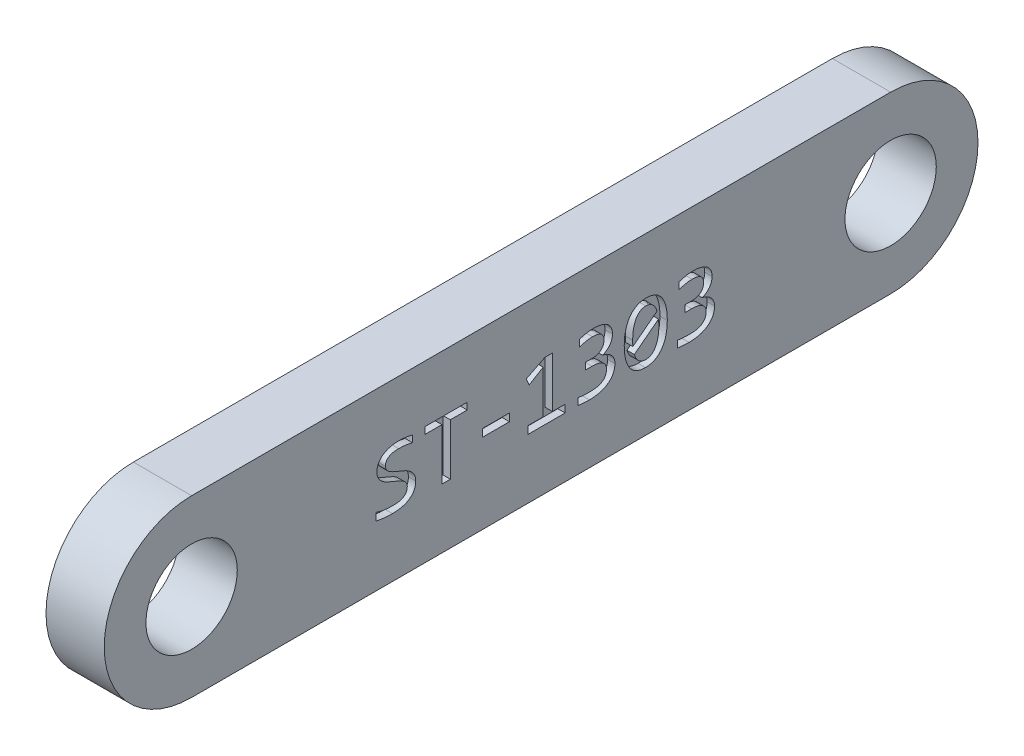
from build123d import *

# Parameters (mm, degrees)
SKETCH1_R           = 2.4892
BOSS_EXTRUDE1_DEPTH = 1.5875
CUT_EXTRUDE1_START  = 1.5875
SKETCH2_W           = 1.472463768
SKETCH2_H           = 0.414130435
CUT_EXTRUDE1_DEPTH  = 0.4


with BuildPart() as part:
    # Sketch1 → Boss-Extrude1 (new, symmetric)
    with BuildSketch(Plane(origin=(0, 0, 0), x_dir=(0, 0, -1), z_dir=(1, 0, 0))):
        with BuildLine():
            Line((0, 4.7625), (38.1, 4.7625))
            ThreePointArc((38.1, 4.7625), (42.8625, 0), (38.1, -4.7625))
            Line((38.1, -4.7625), (0, -4.7625))
            ThreePointArc((0, -4.7625), (-4.7625, 0), (0, 4.7625))
        make_face()
        with Locations((38.1, 0)):
            Circle(SKETCH1_R, mode=Mode.SUBTRACT)
        Circle(SKETCH1_R, mode=Mode.SUBTRACT)
    extrude(amount=BOSS_EXTRUDE1_DEPTH, both=True)

    # Sketch2 → Cut-Extrude1 (cut)
    # profile 1 of 7: a face of its own
    with BuildSketch(Plane(origin=(0, 0, 0), x_dir=(0, 0, -1), z_dir=(1, 0, 0)).offset(CUT_EXTRUDE1_START)):
        with BuildLine():
            add(Edge.make_bspline(
                [(12.214476634, -0.65142106), (12.213443369, -0.688159023), (12.211438851, -0.759430053), (12.193802576, -0.863137638), (12.164390835, -0.959466266), (12.123974417, -1.049075326), (12.071981556, -1.130337377), (12.012593943, -1.206184721), (11.941680158, -1.272900368), (11.863119538, -1.333648082), (11.775685006, -1.387110283), (11.679152831, -1.432103611), (11.574846345, -1.470973785), (11.462475753, -1.502314905), (11.343045812, -1.52667839), (11.217146031, -1.543415301), (11.085408956, -1.554711552), (10.995596429, -1.555970444), (10.94979706, -1.556612409)],
                knots=[0, 0, 0, 0, 1.005643061, 1.95093061, 2.870738502, 3.757832008, 4.633806625, 5.507195241, 6.389247641, 7.292512577, 8.223494331, 9.189475669, 10.205094408, 11.269007441, 12.381228937, 13.540657028, 14.745872513, 16, 16, 16, 16], degree=3))
            add(Edge.make_bspline(
                [(10.94979706, -1.556612409), (10.907611362, -1.55613974), (10.823441949, -1.555196664), (10.698275131, -1.549415195), (10.57582162, -1.539864414), (10.457911238, -1.528379665), (10.345437594, -1.51561287), (10.239890724, -1.500847792), (10.142601973, -1.483679476), (10.081003705, -1.470725736), (10.051795475, -1.464583424)],
                knots=[0, 0, 0, 0, 1.119729043, 2.234096861, 3.324996266, 4.379512959, 5.378439906, 6.329323539, 7.207810484, 8, 8, 8, 8], degree=3))
            Line((10.051795475, -1.464583424), (10.051795475, -1.050452989))
            add(Edge.make_bspline(
                [(10.051795475, -1.050452989), (10.083066619, -1.061167433), (10.146961446, -1.083059742), (10.247186434, -1.108737432), (10.352319162, -1.132852752), (10.463358638, -1.152999601), (10.581386657, -1.168856158), (10.706853532, -1.180007882), (10.840180745, -1.187559738), (10.931571883, -1.188178409), (10.978556118, -1.188496467)],
                knots=[0, 0, 0, 0, 0.842364813, 1.72116351, 2.635659137, 3.591954833, 4.596841017, 5.670471508, 6.802388115, 8, 8, 8, 8], degree=3))
            add(Edge.make_bspline(
                [(10.978556118, -1.188496467), (11.012124092, -1.188150916), (11.076690625, -1.187486264), (11.169727713, -1.180537478), (11.255161814, -1.171478019), (11.332808883, -1.155742491), (11.403448204, -1.13763077), (11.467297249, -1.114582973), (11.524255281, -1.087154756), (11.575315924, -1.05640649), (11.619076011, -1.020879624), (11.657442035, -0.982592348), (11.688230889, -0.939881043), (11.713240908, -0.893759324), (11.731729494, -0.844071217), (11.744568659, -0.79094792), (11.752645298, -0.734588688), (11.753759647, -0.695785956), (11.754331706, -0.675866259)],
                knots=[0, 0, 0, 0, 1.523194236, 2.929797672, 4.233142745, 5.41923506, 6.522104548, 7.540643951, 8.494207191, 9.387815665, 10.238903194, 11.04655015, 11.840679357, 12.619387111, 13.4214478, 14.239285369, 15.096122854, 16, 16, 16, 16], degree=3))
            add(Edge.make_bspline(
                [(11.754331706, -0.675866259), (11.753617789, -0.655168662), (11.752222944, -0.614729909), (11.737975558, -0.55671446), (11.715699869, -0.502914283), (11.683042578, -0.454932565), (11.64466461, -0.409849663), (11.599579242, -0.368539388), (11.549811308, -0.328593215), (11.474296221, -0.278359125), (11.368629665, -0.21933206), (11.22786985, -0.160304066), (11.078602687, -0.10103639), (10.925414461, -0.039219908), (10.772265291, 0.026398534), (10.622019925, 0.095914262), (10.481106958, 0.175663234), (10.374996988, 0.254795587), (10.300860905, 0.326051703), (10.25042507, 0.38310586), (10.207148959, 0.445408524), (10.167171545, 0.51075624), (10.13589481, 0.582972546), (10.114194946, 0.661378834), (10.099794155, 0.745984932), (10.098486738, 0.80444304), (10.097809967, 0.834703261)],
                knots=[0, 0, 0, 0, 0.619815692, 1.2109895, 1.781199776, 2.357496674, 2.943929778, 3.554333405, 4.188738872, 4.856760597, 6.272963823, 7.811824644, 9.431291666, 11.092170587, 12.76691914, 14.429617761, 16.056218893, 17.616396577, 18.384212937, 19.138341755, 19.896401647, 20.65718422, 21.4332038, 22.247956952, 23.09307348, 24, 24, 24, 24], degree=3))
            add(Edge.make_bspline(
                [(10.097809967, 0.834703261), (10.098634876, 0.861836872), (10.10028672, 0.91617076), (10.113931978, 0.997358421), (10.135392497, 1.077836699), (10.165605392, 1.157312879), (10.205180459, 1.233947572), (10.253344347, 1.307416814), (10.312504195, 1.375060707), (10.380341053, 1.438843451), (10.458822469, 1.497200247), (10.546967552, 1.550434811), (10.646210317, 1.596120221), (10.754651004, 1.637578545), (10.874475771, 1.670487821), (11.005090521, 1.694064821), (11.146520815, 1.707371518), (11.244309938, 1.709378282), (11.294905755, 1.710416576)],
                knots=[0, 0, 0, 0, 0.784067079, 1.570060577, 2.373452904, 3.189297991, 4.022898002, 4.862695015, 5.722463422, 6.614650011, 7.550049647, 8.544652583, 9.586108202, 10.704431291, 11.897970904, 13.172772987, 14.537200697, 16, 16, 16, 16], degree=3))
            add(Edge.make_bspline(
                [(11.294905755, 1.710416576), (11.32319619, 1.710233284), (11.381990773, 1.709852358), (11.472582943, 1.703339903), (11.567071787, 1.695126455), (11.663152012, 1.683360619), (11.75907173, 1.669928472), (11.853240246, 1.654092121), (11.943637964, 1.637189944), (12.002165468, 1.624509074), (12.030418663, 1.618387591)],
                knots=[0, 0, 0, 0, 0.91416123, 1.89985515, 2.934260182, 3.979599391, 5.027947684, 6.064525625, 7.065681407, 8, 8, 8, 8], degree=3))
            Line((12.030418663, 1.618387591), (12.030418663, 1.250271649))
            add(Edge.make_bspline(
                [(12.030418663, 1.250271649), (11.967531984, 1.264219497), (11.842382364, 1.291976854), (11.65403204, 1.319666174), (11.469061191, 1.339057536), (11.346959464, 1.341232526), (11.286997014, 1.342300634)],
                knots=[0, 0, 0, 0, 1.029411825, 2.048613503, 3.041701399, 4, 4, 4, 4], degree=3))
            add(Edge.make_bspline(
                [(11.286997014, 1.342300634), (11.256792478, 1.341838949), (11.198244252, 1.340944023), (11.113482511, 1.335441734), (11.034999558, 1.325366015), (10.962715655, 1.311738641), (10.896431041, 1.294874563), (10.836349715, 1.273449488), (10.782802678, 1.247297358), (10.734888983, 1.217913787), (10.693312093, 1.184650055), (10.656762591, 1.149336305), (10.626247731, 1.110936446), (10.601615766, 1.069457325), (10.582339287, 1.02545043), (10.567368735, 0.97909978), (10.559770611, 0.92961858), (10.558569299, 0.895837799), (10.557954895, 0.878560824)],
                knots=[0, 0, 0, 0, 1.491437277, 2.890989782, 4.191431573, 5.395946596, 6.521058188, 7.565423013, 8.539223212, 9.458660202, 10.334655275, 11.163081303, 11.963306063, 12.748694206, 13.538083787, 14.331542868, 15.146677777, 16, 16, 16, 16], degree=3))
            add(Edge.make_bspline(
                [(10.557954895, 0.878560824), (10.55866801, 0.85786525), (10.560061286, 0.817430449), (10.574372917, 0.759170866), (10.596767701, 0.705219408), (10.628078637, 0.655740046), (10.667964248, 0.61164136), (10.711863795, 0.568745113), (10.761807969, 0.528502055), (10.837175045, 0.476975492), (10.943773895, 0.418255952), (11.083843783, 0.356648272), (11.23393873, 0.299069491), (11.386765296, 0.236646792), (11.540464332, 0.171710992), (11.665729153, 0.11130215), (11.762947312, 0.059446088), (11.831076799, 0.015975006), (11.895765964, -0.029872834), (11.95524772, -0.08052479), (12.011067295, -0.134097194), (12.060965511, -0.192983093), (12.105476651, -0.255900155), (12.143856573, -0.323481317), (12.176684169, -0.395863901), (12.198091223, -0.475498372), (12.212498139, -0.561265081), (12.213802007, -0.62067969), (12.214476634, -0.65142106)],
                knots=[0, 0, 0, 0, 0.667485538, 1.304126353, 1.925325377, 2.548259058, 3.18485279, 3.841928735, 4.529978862, 5.253739616, 6.789399884, 8.452896455, 10.194043647, 11.982660287, 13.786213269, 15.583473082, 16.473910229, 17.343881083, 18.192645259, 19.033319022, 19.865571682, 20.689426309, 21.522902605, 22.351690537, 23.197589349, 24.082454772, 25.007853999, 26, 26, 26, 26], degree=3))
        make_face()
    # profile 2 of 7: a face of its own
    with BuildSketch(Plane(origin=(0, 0, 0), x_dir=(0, 0, -1), z_dir=(1, 0, 0)).offset(CUT_EXTRUDE1_START)):
        Polygon((15.021360692, 1.296286141), (14.101070837, 1.296286141), (14.101070837, -1.510597917), (13.640925909, -1.510597917), (13.640925909, 1.296286141), (12.720636054, 1.296286141), (12.720636054, 1.664402083), (15.021360692, 1.664402083), align=None)
    # profile 3 of 7: a face of its own
    with BuildSketch(Plane(origin=(0, 0, 0), x_dir=(0, 0, -1), z_dir=(1, 0, 0)).offset(CUT_EXTRUDE1_START)):
        with Locations((16.585853446, -0.199184874)):
            Rectangle(SKETCH2_W, SKETCH2_H)
    # profile 4 of 7: a face of its own
    with BuildSketch(Plane(origin=(0, 0, 0), x_dir=(0, 0, -1), z_dir=(1, 0, 0)).offset(CUT_EXTRUDE1_START)):
        Polygon((20.359041851, -1.510597917), (18.33440417, -1.510597917), (18.33440417, -1.096467482), (19.16266504, -1.096467482), (19.16266504, 1.250271649), (18.398393074, 0.790126721), (18.242375185, 1.158242663), (19.257569931, 1.664402083), (19.66882446, 1.664402083), (19.66882446, -1.096467482), (20.359041851, -1.096467482), align=None)
    # profile 5 of 7: a face of its own
    with BuildSketch(Plane(origin=(0, 0, 0), x_dir=(0, 0, -1), z_dir=(1, 0, 0)).offset(CUT_EXTRUDE1_START)):
        with BuildLine():
            add(Edge.make_bspline(
                [(23.073896924, -0.533508922), (23.072674729, -0.568311207), (23.070251502, -0.637313167), (23.054422587, -0.739246339), (23.026584987, -0.837705262), (22.988812233, -0.932744755), (22.93927741, -1.022856636), (22.880514205, -1.108570687), (22.8089922, -1.187012732), (22.727703824, -1.260076956), (22.634665658, -1.325404667), (22.53152433, -1.384884438), (22.41630079, -1.435528421), (22.290423601, -1.479330864), (22.153737877, -1.514817931), (22.005917842, -1.53845849), (21.847656643, -1.554024129), (21.73831826, -1.555732044), (21.681958518, -1.556612409)],
                knots=[0, 0, 0, 0, 0.861844565, 1.708766071, 2.546803722, 3.390976017, 4.235482026, 5.088267806, 5.958166408, 6.857625573, 7.789680516, 8.767975323, 9.801402493, 10.901266619, 12.065759824, 13.293144602, 14.604719897, 16, 16, 16, 16], degree=3))
            add(Edge.make_bspline(
                [(21.681958518, -1.556612409), (21.621073388, -1.555880196), (21.505696571, -1.554492658), (21.340875822, -1.545327583), (21.190895951, -1.529624636), (21.095485323, -1.516807681), (21.049259243, -1.510597917)],
                knots=[0, 0, 0, 0, 1.150713897, 2.180593327, 3.118504498, 4, 4, 4, 4], degree=3))
            Line((21.049259243, -1.510597917), (21.049259243, -1.142481975))
            add(Edge.make_bspline(
                [(21.049259243, -1.142481975), (21.101467471, -1.149269883), (21.208330804, -1.163163833), (21.372789285, -1.178345186), (21.543344798, -1.186794627), (21.65894238, -1.187926269), (21.717188364, -1.188496467)],
                knots=[0, 0, 0, 0, 0.942811003, 1.929809335, 2.956896058, 4, 4, 4, 4], degree=3))
            add(Edge.make_bspline(
                [(21.717188364, -1.188496467), (21.755784561, -1.187900855), (21.830425386, -1.186749007), (21.937795789, -1.179220431), (22.036464519, -1.165440409), (22.126602208, -1.146947971), (22.208752603, -1.123572411), (22.282857079, -1.094587174), (22.349075934, -1.061191263), (22.407286283, -1.022596984), (22.458364967, -0.980038475), (22.501521587, -0.932513446), (22.537352441, -0.880786772), (22.565532465, -0.824767767), (22.586857194, -0.764746315), (22.602906084, -0.701008878), (22.612291042, -0.633488388), (22.613259679, -0.587221444), (22.613751996, -0.563705933)],
                knots=[0, 0, 0, 0, 1.490140128, 2.881768065, 4.152352525, 5.333691038, 6.431800578, 7.445549096, 8.401444764, 9.289364022, 10.136425943, 10.961731228, 11.759931868, 12.558561418, 13.375159002, 14.214453508, 15.092482988, 16, 16, 16, 16], degree=3))
            add(Edge.make_bspline(
                [(22.613751996, -0.563705933), (22.613083181, -0.542334989), (22.611781533, -0.500742872), (22.601035097, -0.440355704), (22.581974196, -0.384698371), (22.556808161, -0.333058107), (22.524544836, -0.286112796), (22.487132476, -0.242438603), (22.442833062, -0.203656362), (22.392734082, -0.168991809), (22.33732191, -0.138565645), (22.277416366, -0.11047881), (22.211520815, -0.088943708), (22.141273441, -0.069981928), (22.066665723, -0.056228992), (21.988549103, -0.044833125), (21.906830084, -0.039610327), (21.851162108, -0.038631486), (21.822877902, -0.038134149)],
                knots=[0, 0, 0, 0, 0.962645216, 1.873499504, 2.751163712, 3.60600831, 4.45366029, 5.311093063, 6.190880762, 7.098592726, 8.05100711, 9.036815858, 10.075001357, 11.16993685, 12.313633837, 13.491143935, 14.725281481, 16, 16, 16, 16], degree=3))
            Line((21.822877902, -0.038134149), (21.463389677, -0.038134149))
            Line((21.463389677, -0.038134149), (21.463389677, 0.329981793))
            Line((21.463389677, 0.329981793), (21.833662549, 0.329981793))
            add(Edge.make_bspline(
                [(21.833662549, 0.329981793), (21.857169718, 0.33031632), (21.903341194, 0.330973377), (21.970842644, 0.338477744), (22.035248902, 0.349899026), (22.096350255, 0.3656294), (22.153946184, 0.385587707), (22.20710706, 0.409994702), (22.256061082, 0.438326169), (22.300462759, 0.4707714), (22.341325819, 0.506361561), (22.375702255, 0.547432342), (22.406495064, 0.591363094), (22.431360285, 0.63986321), (22.452049058, 0.691675094), (22.465086552, 0.74769301), (22.474203649, 0.806604456), (22.475200563, 0.847128216), (22.475708518, 0.867776178)],
                knots=[0, 0, 0, 0, 1.192823995, 2.342878639, 3.443008352, 4.511191983, 5.54236148, 6.533123054, 7.476280357, 8.408308338, 9.321648148, 10.218966078, 11.119987697, 12.039625921, 12.979481888, 13.944359475, 14.9525951, 16, 16, 16, 16], degree=3))
            add(Edge.make_bspline(
                [(22.475708518, 0.867776178), (22.47544964, 0.887700436), (22.474945232, 0.926521634), (22.46660902, 0.982318373), (22.454592695, 1.034216376), (22.437395565, 1.081860769), (22.415012437, 1.125432737), (22.387449663, 1.164643107), (22.354806456, 1.199543343), (22.316912233, 1.229659404), (22.274828316, 1.256569749), (22.227761978, 1.27961878), (22.175974117, 1.298417551), (22.120061686, 1.315722268), (22.05924577, 1.327255134), (21.993935828, 1.33573021), (21.924131581, 1.341954136), (21.875857162, 1.342182604), (21.850917984, 1.342300634)],
                knots=[0, 0, 0, 0, 1.064287749, 2.073699511, 3.009236736, 3.9091673, 4.774588449, 5.620725501, 6.46384913, 7.320401755, 8.201989857, 9.130391188, 10.115765889, 11.145550715, 12.256343534, 13.419843727, 14.667058473, 16, 16, 16, 16], degree=3))
            add(Edge.make_bspline(
                [(21.850917984, 1.342300634), (21.795463537, 1.340572855), (21.682065044, 1.33703973), (21.539957928, 1.314328478), (21.423197031, 1.288666795), (21.331846278, 1.264821705), (21.237379902, 1.236720199), (21.17381602, 1.215246153), (21.141288228, 1.204257156)],
                knots=[0, 0, 0, 0, 1.374009053, 2.809703548, 3.557729416, 4.33717134, 5.149074242, 6, 6, 6, 6], degree=3))
            Line((21.141288228, 1.204257156), (21.141288228, 1.572373098))
            add(Edge.make_bspline(
                [(21.141288228, 1.572373098), (21.17041508, 1.583014623), (21.229822631, 1.604719233), (21.32220031, 1.631321927), (21.4168938, 1.655030641), (21.512696027, 1.674193929), (21.608076476, 1.690275513), (21.702612417, 1.701524967), (21.794948355, 1.709278785), (21.855696227, 1.710042689), (21.885428853, 1.710416576)],
                knots=[0, 0, 0, 0, 0.978322217, 1.995400233, 3.031781794, 4.058180853, 5.077730371, 6.083355555, 7.06191161, 8, 8, 8, 8], degree=3))
            add(Edge.make_bspline(
                [(21.885428853, 1.710416576), (21.927392204, 1.709731741), (22.00856932, 1.708406943), (22.126454364, 1.698079113), (22.236605516, 1.682087468), (22.339039059, 1.658413769), (22.433295182, 1.627967473), (22.520347729, 1.593181694), (22.598906874, 1.551450567), (22.669349287, 1.503750208), (22.731438975, 1.45028506), (22.786028962, 1.391673247), (22.83227385, 1.327476308), (22.869861902, 1.257745373), (22.89922972, 1.183355705), (22.921298321, 1.10443987), (22.933234451, 1.020564877), (22.934968595, 0.96319507), (22.935853446, 0.933922011)],
                knots=[0, 0, 0, 0, 1.364346343, 2.639295939, 3.84503498, 4.981142705, 6.053223054, 7.063352329, 8.025569508, 8.939887992, 9.824051135, 10.684331437, 11.538625567, 12.389464824, 13.253408307, 14.134440564, 15.048094572, 16, 16, 16, 16], degree=3))
            add(Edge.make_bspline(
                [(22.935853446, 0.933922011), (22.934391272, 0.890867326), (22.931558859, 0.807465), (22.90405575, 0.687682572), (22.859740859, 0.578223571), (22.795553352, 0.480960515), (22.717009446, 0.394272691), (22.625230032, 0.317119204), (22.521313893, 0.247599676), (22.444147314, 0.211770852), (22.40452985, 0.193376268)],
                knots=[0, 0, 0, 0, 1.062433809, 2.058067584, 3.019272504, 3.965418163, 4.921501302, 5.900439357, 6.922081703, 8, 8, 8, 8], degree=3))
            add(Edge.make_bspline(
                [(22.40452985, 0.193376268), (22.445678808, 0.184914245), (22.529128562, 0.16775333), (22.648214639, 0.116142641), (22.761562181, 0.050013997), (22.846019245, -0.021076283), (22.906599599, -0.084979509), (22.947380374, -0.137708592), (22.984700044, -0.194030669), (23.016000712, -0.255104859), (23.042123983, -0.319673405), (23.061046384, -0.38786015), (23.071889632, -0.459582036), (23.073219169, -0.508547764), (23.073896924, -0.533508922)],
                knots=[0, 0, 0, 0, 1.405413986, 2.85016813, 4.327699737, 5.794019892, 6.533135325, 7.277475483, 8.026443619, 8.795662385, 9.574684764, 10.358501172, 11.163216512, 12, 12, 12, 12], degree=3))
        make_face()
    # profile 6 of 7: a face of its own
    with BuildSketch(Plane(origin=(0, 0, 0), x_dir=(0, 0, -1), z_dir=(1, 0, 0)).offset(CUT_EXTRUDE1_START)):
        with BuildLine():
            add(Edge.make_bspline(
                [(25.926795475, 0.07546413), (25.926139618, 0.015994715), (25.924854953, -0.100491674), (25.909757002, -0.270884301), (25.887204042, -0.433518818), (25.854994438, -0.587782567), (25.814125335, -0.733144522), (25.761656201, -0.867840131), (25.70113294, -0.992456168), (25.630425946, -1.106074737), (25.550477088, -1.207926254), (25.461225548, -1.298228916), (25.362524171, -1.376109775), (25.254345615, -1.441291625), (25.137093482, -1.493964728), (25.009417501, -1.529924187), (24.872418654, -1.553058585), (24.77773045, -1.555404584), (24.72898071, -1.556612409)],
                knots=[0, 0, 0, 0, 1.248871528, 2.446241243, 3.590357027, 4.69618527, 5.754202854, 6.758290001, 7.728669934, 8.660396172, 9.563796911, 10.443071522, 11.321307858, 12.197637495, 13.090115231, 14.012601613, 14.976798049, 16, 16, 16, 16], degree=3))
            add(Edge.make_bspline(
                [(24.72898071, -1.556612409), (24.686738747, -1.555584107), (24.603535785, -1.553558686), (24.481736762, -1.535289095), (24.365932255, -1.504797807), (24.255911979, -1.463514984), (24.152996233, -1.408322053), (24.057727013, -1.340281967), (23.969695876, -1.259725803), (23.890407314, -1.165239785), (23.819074373, -1.057784164), (23.757194897, -0.936185632), (23.703696299, -0.801570651), (23.658022675, -0.653383266), (23.623550997, -0.490895538), (23.597654487, -0.314680079), (23.582752003, -0.124189259), (23.580975664, 0.007374879), (23.580056344, 0.07546413)],
                knots=[0, 0, 0, 0, 0.897102697, 1.767001224, 2.609309556, 3.43771295, 4.257811968, 5.082953918, 5.919052252, 6.786174452, 7.6970727, 8.653553743, 9.679470751, 10.771494031, 11.944028827, 13.204944144, 14.553456404, 16, 16, 16, 16], degree=3))
            add(Edge.make_bspline(
                [(23.580056344, 0.07546413), (23.581127996, 0.134921882), (23.58323095, 0.251598645), (23.596604775, 0.422631876), (23.620436339, 0.585660428), (23.653155558, 0.740218111), (23.69535327, 0.885753782), (23.746898243, 1.020989869), (23.807365724, 1.145646838), (23.8772891, 1.25941821), (23.956882535, 1.361667443), (24.04637962, 1.451992783), (24.145147776, 1.530132497), (24.253983126, 1.595083253), (24.371729423, 1.647642418), (24.49936049, 1.683654315), (24.635627896, 1.706834177), (24.729600427, 1.709200878), (24.777871109, 1.710416576)],
                knots=[0, 0, 0, 0, 1.248165713, 2.449334701, 3.598380242, 4.704508407, 5.763215836, 6.776019403, 7.739017366, 8.667464557, 9.574217704, 10.452902578, 11.330549874, 12.210601904, 13.107080692, 14.028948355, 14.987533857, 16, 16, 16, 16], degree=3))
            add(Edge.make_bspline(
                [(24.777871109, 1.710416576), (24.820114066, 1.709388275), (24.903318985, 1.707362857), (25.024873994, 1.689127722), (25.140596838, 1.658710141), (25.250177155, 1.616204936), (25.353654831, 1.561883287), (25.448670563, 1.493085292), (25.536466977, 1.412081222), (25.61554576, 1.316967242), (25.687140212, 1.209122336), (25.749587985, 1.087781774), (25.802576242, 0.952671417), (25.847693102, 0.804643321), (25.883676457, 0.642438338), (25.909093967, 0.466304791), (25.924147835, 0.275603703), (25.925891523, 0.143795368), (25.926795475, 0.07546413)],
                knots=[0, 0, 0, 0, 0.896490568, 1.765795528, 2.602608418, 3.432274242, 4.256303472, 5.076742829, 5.915718828, 6.786140009, 7.696416714, 8.659101079, 9.677705081, 10.773848187, 11.941709476, 13.20176442, 14.549356535, 16, 16, 16, 16], degree=3))
        make_face()
        with BuildLine():
            add(Edge.make_bspline(
                [(25.466650547, 0.051018931), (25.466488005, 0.078592089), (25.466164055, 0.133545979), (25.460039733, 0.215436518), (25.454920484, 0.296266691), (25.449777271, 0.349644749), (25.447238183, 0.375996286)],
                knots=[0, 0, 0, 0, 1.015676625, 2.024265076, 3.024624451, 4, 4, 4, 4], degree=3))
            Line((25.447238183, 0.375996286), (24.130073328, -0.636322554))
            add(Edge.make_bspline(
                [(24.130073328, -0.636322554), (24.143038938, -0.675165402), (24.168469792, -0.751352083), (24.217544949, -0.858757596), (24.277697394, -0.954685766), (24.35000892, -1.036354702), (24.434084876, -1.101940306), (24.512377531, -1.14379005), (24.580672481, -1.166411374), (24.63540964, -1.17974678), (24.693824345, -1.186502914), (24.733760226, -1.187822768), (24.754144886, -1.188496467)],
                knots=[0, 0, 0, 0, 1.361870802, 2.671184605, 3.91877896, 5.116024374, 6.280451232, 7.450298556, 8.047911377, 8.670688444, 9.321473259, 10, 10, 10, 10], degree=3))
            add(Edge.make_bspline(
                [(24.754144886, -1.188496467), (24.780589043, -1.187583433), (24.832723278, -1.185783399), (24.908782464, -1.169859974), (24.981373335, -1.145766305), (25.049633108, -1.11043126), (25.114040639, -1.066093544), (25.17213131, -1.010272039), (25.226828763, -0.946707651), (25.27544199, -0.872743535), (25.319258628, -0.789606542), (25.358242369, -0.697082047), (25.390865043, -0.59496218), (25.418005077, -0.483423471), (25.440340132, -0.362983518), (25.455833455, -0.233071993), (25.465296639, -0.094117709), (25.466189852, 0.001633228), (25.466650547, 0.051018931)],
                knots=[0, 0, 0, 0, 0.796240393, 1.569775284, 2.332781704, 3.095240773, 3.878796528, 4.681173991, 5.516437293, 6.40201063, 7.34239963, 8.345981007, 9.424260963, 10.57011489, 11.804224653, 13.114209461, 14.5115885, 16, 16, 16, 16], degree=3))
        make_face(mode=Mode.SUBTRACT)
        with BuildLine():
            add(Edge.make_bspline(
                [(24.040201272, 0.080496966), (24.040171371, 0.054853337), (24.040111568, 0.00356496), (24.040557409, -0.07290356), (24.043093936, -0.148238768), (24.047415815, -0.19776092), (24.049547966, -0.22219212)],
                knots=[0, 0, 0, 0, 1.015676347, 2.03139705, 3.028811753, 4, 4, 4, 4], degree=3))
            Line((24.049547966, -0.22219212), (25.367431797, 0.790126721))
            add(Edge.make_bspline(
                [(25.367431797, 0.790126721), (25.354967823, 0.82956172), (25.330729458, 0.906249931), (25.279396317, 1.012271306), (25.220767886, 1.107954809), (25.148461268, 1.188316826), (25.06662937, 1.25552871), (24.988428895, 1.296287797), (24.921530159, 1.320313402), (24.867844242, 1.333507177), (24.811117787, 1.340289531), (24.772374225, 1.341623483), (24.752706933, 1.342300634)],
                knots=[0, 0, 0, 0, 1.387569518, 2.698370158, 3.946895934, 5.144331536, 6.312393877, 7.486406228, 8.084826247, 8.697958228, 9.339048001, 10, 10, 10, 10], degree=3))
            add(Edge.make_bspline(
                [(24.752706933, 1.342300634), (24.726272121, 1.341360288), (24.674156309, 1.339506412), (24.598108203, 1.324005893), (24.525844842, 1.298418182), (24.457305401, 1.263023643), (24.392781175, 1.21768565), (24.334538202, 1.1608926), (24.279027081, 1.096278508), (24.230791016, 1.019947269), (24.186892444, 0.935079033), (24.148606473, 0.840437254), (24.116218259, 0.736417928), (24.087764589, 0.623254386), (24.066781517, 0.500625631), (24.050938018, 0.368912713), (24.041581111, 0.227783729), (24.040670655, 0.13059983), (24.040201272, 0.080496966)],
                knots=[0, 0, 0, 0, 0.786453526, 1.550480632, 2.299704824, 3.062398082, 3.840423392, 4.637837687, 5.478332318, 6.370910143, 7.318703432, 8.320397478, 9.40580758, 10.560070273, 11.791787257, 13.106920475, 14.508481623, 16, 16, 16, 16], degree=3))
        make_face(mode=Mode.SUBTRACT)
    # profile 7 of 7: a face of its own
    with BuildSketch(Plane(origin=(0, 0, 0), x_dir=(0, 0, -1), z_dir=(1, 0, 0)).offset(CUT_EXTRUDE1_START)):
        with BuildLine():
            add(Edge.make_bspline(
                [(28.503607069, -0.533508922), (28.502384874, -0.568311207), (28.499961647, -0.637313167), (28.484132732, -0.739246339), (28.456295132, -0.837705262), (28.418522378, -0.932744755), (28.368987555, -1.022856636), (28.31022435, -1.108570687), (28.238702345, -1.187012732), (28.157413969, -1.260076956), (28.064375802, -1.325404667), (27.961234475, -1.384884438), (27.846010935, -1.435528421), (27.720133746, -1.479330864), (27.583448022, -1.514817931), (27.435627987, -1.53845849), (27.277366788, -1.554024129), (27.168028405, -1.555732044), (27.111668663, -1.556612409)],
                knots=[0, 0, 0, 0, 0.861844565, 1.708766071, 2.546803722, 3.390976017, 4.235482026, 5.088267806, 5.958166408, 6.857625573, 7.789680516, 8.767975323, 9.801402493, 10.901266619, 12.065759824, 13.293144602, 14.604719897, 16, 16, 16, 16], degree=3))
            add(Edge.make_bspline(
                [(27.111668663, -1.556612409), (27.050783533, -1.555880196), (26.935406716, -1.554492658), (26.770585967, -1.545327583), (26.620606096, -1.529624636), (26.525195468, -1.516807681), (26.478969388, -1.510597917)],
                knots=[0, 0, 0, 0, 1.150713897, 2.180593327, 3.118504498, 4, 4, 4, 4], degree=3))
            Line((26.478969388, -1.510597917), (26.478969388, -1.142481975))
            add(Edge.make_bspline(
                [(26.478969388, -1.142481975), (26.531177616, -1.149269883), (26.638040949, -1.163163833), (26.80249943, -1.178345186), (26.973054943, -1.186794627), (27.088652525, -1.187926269), (27.146898509, -1.188496467)],
                knots=[0, 0, 0, 0, 0.942811003, 1.929809335, 2.956896058, 4, 4, 4, 4], degree=3))
            add(Edge.make_bspline(
                [(27.146898509, -1.188496467), (27.185494706, -1.187900855), (27.260135531, -1.186749007), (27.367505934, -1.179220431), (27.466174664, -1.165440409), (27.556312353, -1.146947971), (27.638462748, -1.123572411), (27.712567224, -1.094587174), (27.778786079, -1.061191263), (27.836996427, -1.022596984), (27.888075112, -0.980038475), (27.931231732, -0.932513446), (27.967062586, -0.880786772), (27.995242609, -0.824767767), (28.016567339, -0.764746315), (28.032616229, -0.701008878), (28.042001187, -0.633488388), (28.042969824, -0.587221444), (28.043462141, -0.563705933)],
                knots=[0, 0, 0, 0, 1.490140128, 2.881768065, 4.152352525, 5.333691038, 6.431800578, 7.445549096, 8.401444764, 9.289364022, 10.136425943, 10.961731228, 11.759931868, 12.558561418, 13.375159002, 14.214453508, 15.092482988, 16, 16, 16, 16], degree=3))
            add(Edge.make_bspline(
                [(28.043462141, -0.563705933), (28.042793326, -0.542334989), (28.041491678, -0.500742872), (28.030745242, -0.440355704), (28.011684341, -0.384698371), (27.986518306, -0.333058107), (27.95425498, -0.286112796), (27.916842621, -0.242438603), (27.872543207, -0.203656362), (27.822444227, -0.168991809), (27.767032055, -0.138565645), (27.707126511, -0.11047881), (27.64123096, -0.088943708), (27.570983586, -0.069981928), (27.496375868, -0.056228992), (27.418259248, -0.044833125), (27.336540229, -0.039610327), (27.280872253, -0.038631486), (27.252588047, -0.038134149)],
                knots=[0, 0, 0, 0, 0.962645216, 1.873499504, 2.751163712, 3.60600831, 4.45366029, 5.311093063, 6.190880762, 7.098592726, 8.05100711, 9.036815858, 10.075001357, 11.16993685, 12.313633837, 13.491143935, 14.725281481, 16, 16, 16, 16], degree=3))
            Line((27.252588047, -0.038134149), (26.893099822, -0.038134149))
            Line((26.893099822, -0.038134149), (26.893099822, 0.329981793))
            Line((26.893099822, 0.329981793), (27.263372694, 0.329981793))
            add(Edge.make_bspline(
                [(27.263372694, 0.329981793), (27.286879863, 0.33031632), (27.333051339, 0.330973377), (27.400552789, 0.338477744), (27.464959047, 0.349899026), (27.5260604, 0.3656294), (27.583656329, 0.385587707), (27.636817205, 0.409994702), (27.685771227, 0.438326169), (27.730172904, 0.4707714), (27.771035964, 0.506361561), (27.8054124, 0.547432342), (27.836205209, 0.591363094), (27.86107043, 0.63986321), (27.881759203, 0.691675094), (27.894796697, 0.74769301), (27.903913794, 0.806604456), (27.904910708, 0.847128216), (27.905418663, 0.867776178)],
                knots=[0, 0, 0, 0, 1.192823995, 2.342878639, 3.443008352, 4.511191983, 5.54236148, 6.533123054, 7.476280357, 8.408308338, 9.321648148, 10.218966078, 11.119987697, 12.039625921, 12.979481888, 13.944359475, 14.9525951, 16, 16, 16, 16], degree=3))
            add(Edge.make_bspline(
                [(27.905418663, 0.867776178), (27.905159785, 0.887700436), (27.904655377, 0.926521634), (27.896319165, 0.982318373), (27.88430284, 1.034216376), (27.86710571, 1.081860769), (27.844722582, 1.125432737), (27.817159808, 1.164643107), (27.784516601, 1.199543343), (27.746622378, 1.229659404), (27.704538461, 1.256569749), (27.657472123, 1.27961878), (27.605684262, 1.298417551), (27.549771831, 1.315722268), (27.488955915, 1.327255134), (27.423645973, 1.33573021), (27.353841726, 1.341954136), (27.305567307, 1.342182604), (27.280628129, 1.342300634)],
                knots=[0, 0, 0, 0, 1.064287749, 2.073699511, 3.009236736, 3.9091673, 4.774588449, 5.620725501, 6.46384913, 7.320401755, 8.201989857, 9.130391188, 10.115765889, 11.145550715, 12.256343534, 13.419843727, 14.667058473, 16, 16, 16, 16], degree=3))
            add(Edge.make_bspline(
                [(27.280628129, 1.342300634), (27.225173682, 1.340572855), (27.111775189, 1.33703973), (26.969668073, 1.314328478), (26.852907176, 1.288666795), (26.761556423, 1.264821705), (26.667090047, 1.236720199), (26.603526165, 1.215246153), (26.570998373, 1.204257156)],
                knots=[0, 0, 0, 0, 1.374009053, 2.809703548, 3.557729416, 4.33717134, 5.149074242, 6, 6, 6, 6], degree=3))
            Line((26.570998373, 1.204257156), (26.570998373, 1.572373098))
            add(Edge.make_bspline(
                [(26.570998373, 1.572373098), (26.600125225, 1.583014623), (26.659532776, 1.604719233), (26.751910455, 1.631321927), (26.846603945, 1.655030641), (26.942406172, 1.674193929), (27.037786621, 1.690275513), (27.132322562, 1.701524967), (27.2246585, 1.709278785), (27.285406372, 1.710042689), (27.315138998, 1.710416576)],
                knots=[0, 0, 0, 0, 0.978322217, 1.995400233, 3.031781794, 4.058180853, 5.077730371, 6.083355555, 7.06191161, 8, 8, 8, 8], degree=3))
            add(Edge.make_bspline(
                [(27.315138998, 1.710416576), (27.357102349, 1.709731741), (27.438279465, 1.708406943), (27.556164509, 1.698079113), (27.666315661, 1.682087468), (27.768749204, 1.658413769), (27.863005327, 1.627967473), (27.950057874, 1.593181694), (28.028617019, 1.551450567), (28.099059432, 1.503750208), (28.16114912, 1.45028506), (28.215739107, 1.391673247), (28.261983995, 1.327476308), (28.299572047, 1.257745373), (28.328939864, 1.183355705), (28.351008466, 1.10443987), (28.362944596, 1.020564877), (28.36467874, 0.96319507), (28.365563591, 0.933922011)],
                knots=[0, 0, 0, 0, 1.364346343, 2.639295939, 3.84503498, 4.981142705, 6.053223054, 7.063352329, 8.025569508, 8.939887992, 9.824051135, 10.684331437, 11.538625567, 12.389464824, 13.253408307, 14.134440564, 15.048094572, 16, 16, 16, 16], degree=3))
            add(Edge.make_bspline(
                [(28.365563591, 0.933922011), (28.364101417, 0.890867326), (28.361269004, 0.807465), (28.333765895, 0.687682572), (28.289451004, 0.578223571), (28.225263497, 0.480960515), (28.146719591, 0.394272691), (28.054940177, 0.317119204), (27.951024038, 0.247599676), (27.873857458, 0.211770852), (27.834239995, 0.193376268)],
                knots=[0, 0, 0, 0, 1.062433809, 2.058067584, 3.019272504, 3.965418163, 4.921501302, 5.900439357, 6.922081703, 8, 8, 8, 8], degree=3))
            add(Edge.make_bspline(
                [(27.834239995, 0.193376268), (27.875388953, 0.184914245), (27.958838707, 0.16775333), (28.077924784, 0.116142641), (28.191272325, 0.050013997), (28.27572939, -0.021076283), (28.336309744, -0.084979509), (28.377090518, -0.137708592), (28.414410189, -0.194030669), (28.445710857, -0.255104859), (28.471834128, -0.319673405), (28.490756529, -0.38786015), (28.501599777, -0.459582036), (28.502929314, -0.508547764), (28.503607069, -0.533508922)],
                knots=[0, 0, 0, 0, 1.405413986, 2.85016813, 4.327699737, 5.794019892, 6.533135325, 7.277475483, 8.026443619, 8.795662385, 9.574684764, 10.358501172, 11.163216512, 12, 12, 12, 12], degree=3))
        make_face()
    extrude(amount=-CUT_EXTRUDE1_DEPTH, mode=Mode.SUBTRACT)


solid = part.part
